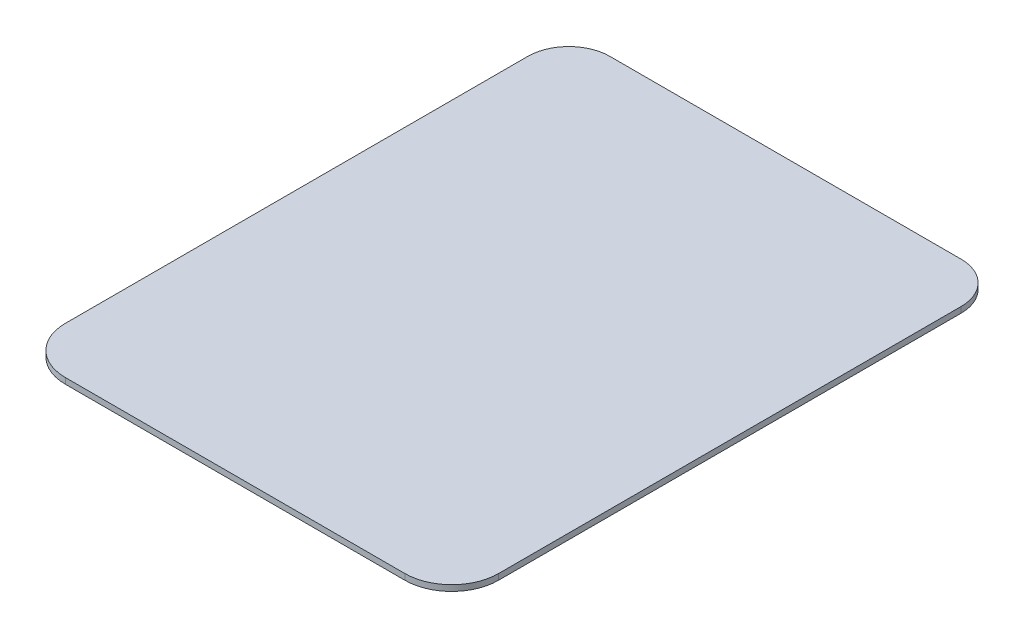
from build123d import *

# Parameters (mm, degrees)
AUFSATZ_LINEAR_AUSTRAGEN1_DEPTH = 1


with BuildPart() as part:
    # Skizze1 → Aufsatz-Linear austragen1 (new body)
    with BuildSketch(Plane(origin=(0, 0, 0), x_dir=(1, 0, 0), z_dir=(0, 1, 0))):
        with BuildLine():
            Line((-30, 47), (30, 47))
            ThreePointArc((30, 47), (34.949747468, 44.949747468), (37, 40))
            Line((37, 40), (37, -39))
            ThreePointArc((37, -39), (34.656854249, -44.656854249), (29, -47))
            Line((29, -47), (-29, -47))
            ThreePointArc((-29, -47), (-34.656854249, -44.656854249), (-37, -39))
            Line((-37, -39), (-37, 40))
            ThreePointArc((-37, 40), (-34.949747468, 44.949747468), (-30, 47))
        make_face()
    extrude(amount=AUFSATZ_LINEAR_AUSTRAGEN1_DEPTH)


solid = part.part
